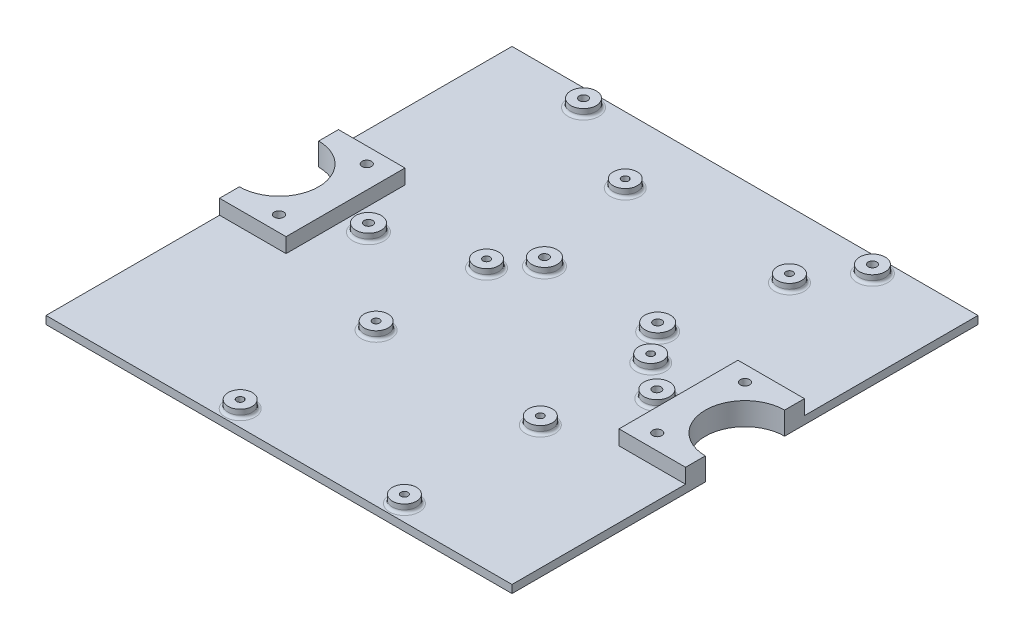
from build123d import *

# Parameters (mm, degrees)
SKETCH1_W               = 164.6
SKETCH1_H               = 164.6
BOSS_EXTRUDE1_DEPTH     = 2.8
SKETCH2_W               = 23.5
SKETCH2_H               = 42
BOSS_EXTRUDE2_DEPTH     = 5.2
CUT_EXTRUDE1_DEPTH      = 117.664390454
CUT_EXTRUDE1_DEPTH_BACK = 117.664390454
SKETCH3_R               = 14
SKETCH4_R               = 1.65
CUT_EXTRUDE2_DEPTH      = 117.664390454
SKETCH5_R               = 3
CUT_EXTRUDE3_DEPTH      = 3.2
SKETCH6_R               = 1.25
SKETCH6_R_2             = 1.5
CUT_EXTRUDE4_DEPTH      = 117.50587968
BOSS_EXTRUDE3_START     = 2.8
SKETCH7_R               = 4.25
SKETCH7_R_2             = 1.25
SKETCH7_R_3             = 4.5
SKETCH7_R_4             = 1.5
BOSS_EXTRUDE3_DEPTH     = 2.8
FILLET1_R               = 1


with BuildPart() as part:
    # Sketch1 → Boss-Extrude1 (new body)
    with BuildSketch(Plane(origin=(0, 0, 0), x_dir=(1, 0, 0), z_dir=(0, 1, 0))):
        Rectangle(SKETCH1_W, SKETCH1_H)
    extrude(amount=-BOSS_EXTRUDE1_DEPTH)

    # Sketch2 → Boss-Extrude2 (add)
    with BuildSketch(Plane(origin=(0, 0, 0), x_dir=(1, 0, 0), z_dir=(0, 1, 0))):
        with Locations((-70.55, 0)):
            Rectangle(SKETCH2_W, SKETCH2_H)
        with Locations((70.55, 0)):
            Rectangle(SKETCH2_W, SKETCH2_H)
    extrude(amount=BOSS_EXTRUDE2_DEPTH)

    # Sketch3 → Cut-Extrude1 (cut, two sides: drawn at the far end of the back side and taken through both)
    with BuildSketch(Plane.XZ.offset(2.8).offset(-CUT_EXTRUDE1_DEPTH_BACK)):
        with Locations((82.3, 0)):
            Circle(SKETCH3_R)
        with Locations((-82.3, 0)):
            Circle(SKETCH3_R)
    extrude(amount=CUT_EXTRUDE1_DEPTH + CUT_EXTRUDE1_DEPTH_BACK, mode=Mode.SUBTRACT)

    # Sketch4 → Cut-Extrude2 (cut, through all)
    with BuildSketch(Plane.XZ.offset(2.8)):
        with Locations(Location((-66.8, 15.5, 0), (0, 0, 270))):
            Circle(SKETCH4_R)
        with Locations(Location((-66.8, -15.5, 0), (0, 0, 270))):
            Circle(SKETCH4_R)
        with Locations(Location((66.8, 15.5, 0), (0, 0, 90))):
            Circle(SKETCH4_R)
        with Locations(Location((66.8, -15.5, 0), (0, 0, 90))):
            Circle(SKETCH4_R)
    extrude(amount=-CUT_EXTRUDE2_DEPTH, mode=Mode.SUBTRACT)

    # Sketch5 → Cut-Extrude3 (cut)
    with BuildSketch(Plane.XZ.offset(2.8)):
        with Locations(Location((66.8, 15.5, 0), (0, 0, 270))):
            Circle(SKETCH5_R)
        with Locations(Location((66.8, -15.5, 0), (0, 0, 270))):
            Circle(SKETCH5_R)
        with Locations(Location((-66.8, -15.5, 0), (0, 0, 270))):
            Circle(SKETCH5_R)
        with Locations(Location((-66.8, 15.5, 0), (0, 0, 270))):
            Circle(SKETCH5_R)
    extrude(amount=-CUT_EXTRUDE3_DEPTH, mode=Mode.SUBTRACT)

    # Sketch6 → Cut-Extrude4 (cut, through all)
    with BuildSketch(Plane(origin=(0, 0, 0), x_dir=(1, 0, 0), z_dir=(0, 1, 0))):
        with Locations(Location((-19.5, -76.5, 0), (0, 0, 270))):
            Circle(SKETCH6_R)
        with Locations(Location((-19.5, -28.5, 0), (0, 0, 270))):
            Circle(SKETCH6_R)
        with Locations(Location((38.5, -28.5, 0), (0, 0, 270))):
            Circle(SKETCH6_R)
        with Locations(Location((38.5, -76.5, 0), (0, 0, 270))):
            Circle(SKETCH6_R)
        with Locations(Location((-9.321007657, 20.777999975, 0), (0, 0, 270))):
            Circle(SKETCH6_R_2)
        with Locations(Location((30.679013943, 20.777999975, 0), (0, 0, 270))):
            Circle(SKETCH6_R_2)
        with Locations(Location((-50.86985, 0.1725, 0), (0, 0, 270))):
            Circle(SKETCH6_R_2)
        with Locations(Location((-19.00000146, 9.99999832, 0), (0, 0, 270))):
            Circle(SKETCH6_R)
        with Locations(Location((38.99999938, 9.99999832, 0), (0, 0, 270))):
            Circle(SKETCH6_R)
        with Locations(Location((50.98415, 0.1725, 0), (0, 0, 270))):
            Circle(SKETCH6_R_2)
        with Locations(Location((50.84445, 76.4741, 0), (0, 0, 270))):
            Circle(SKETCH6_R_2)
        with Locations(Location((-51.00955, 76.2709, 0), (0, 0, 270))):
            Circle(SKETCH6_R_2)
        with Locations(Location((-19.00000146, 58.99999938, 0), (0, 0, 270))):
            Circle(SKETCH6_R)
        with Locations(Location((38.99999938, 58.99999938, 0), (0, 0, 270))):
            Circle(SKETCH6_R)
    extrude(amount=-CUT_EXTRUDE4_DEPTH, mode=Mode.SUBTRACT)

    # Sketch7 → Boss-Extrude3 (add)
    # profile 1 of 14: a face of its own
    with BuildSketch(Plane(origin=(0, 0, 0), x_dir=(1, 0, 0), z_dir=(0, 1, 0)).offset(BOSS_EXTRUDE3_START)):
        with Locations(Location((38.5, -76.5, 0), (0, 0, 90))):
            Circle(SKETCH7_R)
        with Locations(Location((38.5, -76.5, 0), (0, 0, 270))):
            Circle(SKETCH7_R_2, mode=Mode.SUBTRACT)
    # profile 2 of 14: a face of its own
    with BuildSketch(Plane(origin=(0, 0, 0), x_dir=(1, 0, 0), z_dir=(0, 1, 0)).offset(BOSS_EXTRUDE3_START)):
        with Locations(Location((-19.5, -76.5, 0), (0, 0, 90))):
            Circle(SKETCH7_R)
        with Locations(Location((-19.5, -76.5, 0), (0, 0, 270))):
            Circle(SKETCH7_R_2, mode=Mode.SUBTRACT)
    # profile 3 of 14: a face of its own
    with BuildSketch(Plane(origin=(0, 0, 0), x_dir=(1, 0, 0), z_dir=(0, 1, 0)).offset(BOSS_EXTRUDE3_START)):
        with Locations(Location((-19.5, -28.5, 0), (0, 0, 90))):
            Circle(SKETCH7_R)
        with Locations(Location((-19.5, -28.5, 0), (0, 0, 270))):
            Circle(SKETCH7_R_2, mode=Mode.SUBTRACT)
    # profile 4 of 14: a face of its own
    with BuildSketch(Plane(origin=(0, 0, 0), x_dir=(1, 0, 0), z_dir=(0, 1, 0)).offset(BOSS_EXTRUDE3_START)):
        with Locations(Location((38.5, -28.5, 0), (0, 0, 90))):
            Circle(SKETCH7_R)
        with Locations(Location((38.5, -28.5, 0), (0, 0, 270))):
            Circle(SKETCH7_R_2, mode=Mode.SUBTRACT)
    # profile 5 of 14: a face of its own
    with BuildSketch(Plane(origin=(0, 0, 0), x_dir=(1, 0, 0), z_dir=(0, 1, 0)).offset(BOSS_EXTRUDE3_START)):
        with Locations(Location((50.98415, 0.1725, 0), (0, 0, 90))):
            Circle(SKETCH7_R_3)
        with Locations(Location((50.98415, 0.1725, 0), (0, 0, 270))):
            Circle(SKETCH7_R_4, mode=Mode.SUBTRACT)
    # profile 6 of 14: a face of its own
    with BuildSketch(Plane(origin=(0, 0, 0), x_dir=(1, 0, 0), z_dir=(0, 1, 0)).offset(BOSS_EXTRUDE3_START)):
        with Locations(Location((38.99999938, 9.99999832, 0), (0, 0, 90))):
            Circle(SKETCH7_R)
        with Locations(Location((38.99999938, 9.99999832, 0), (0, 0, 270))):
            Circle(SKETCH7_R_2, mode=Mode.SUBTRACT)
    # profile 7 of 14: a face of its own
    with BuildSketch(Plane(origin=(0, 0, 0), x_dir=(1, 0, 0), z_dir=(0, 1, 0)).offset(BOSS_EXTRUDE3_START)):
        with Locations(Location((30.679013943, 20.777999975, 0), (0, 0, 90))):
            Circle(SKETCH7_R_3)
        with Locations(Location((30.679013943, 20.777999975, 0), (0, 0, 270))):
            Circle(SKETCH7_R_4, mode=Mode.SUBTRACT)
    # profile 8 of 14: a face of its own
    with BuildSketch(Plane(origin=(0, 0, 0), x_dir=(1, 0, 0), z_dir=(0, 1, 0)).offset(BOSS_EXTRUDE3_START)):
        with Locations(Location((-9.321007657, 20.777999975, 0), (0, 0, 90))):
            Circle(SKETCH7_R_3)
        with Locations(Location((-9.321007657, 20.777999975, 0), (0, 0, 270))):
            Circle(SKETCH7_R_4, mode=Mode.SUBTRACT)
    # profile 9 of 14: a face of its own
    with BuildSketch(Plane(origin=(0, 0, 0), x_dir=(1, 0, 0), z_dir=(0, 1, 0)).offset(BOSS_EXTRUDE3_START)):
        with Locations(Location((-19.00000146, 9.99999832, 0), (0, 0, 90))):
            Circle(SKETCH7_R)
        with Locations(Location((-19.00000146, 9.99999832, 0), (0, 0, 270))):
            Circle(SKETCH7_R_2, mode=Mode.SUBTRACT)
    # profile 10 of 14: a face of its own
    with BuildSketch(Plane(origin=(0, 0, 0), x_dir=(1, 0, 0), z_dir=(0, 1, 0)).offset(BOSS_EXTRUDE3_START)):
        with Locations(Location((-50.86985, 0.1725, 0), (0, 0, 90))):
            Circle(SKETCH7_R_3)
        with Locations(Location((-50.86985, 0.1725, 0), (0, 0, 270))):
            Circle(SKETCH7_R_4, mode=Mode.SUBTRACT)
    # profile 11 of 14: a face of its own
    with BuildSketch(Plane(origin=(0, 0, 0), x_dir=(1, 0, 0), z_dir=(0, 1, 0)).offset(BOSS_EXTRUDE3_START)):
        with Locations(Location((50.84445, 76.4741, 0), (0, 0, 90))):
            Circle(SKETCH7_R_3)
        with Locations(Location((50.84445, 76.4741, 0), (0, 0, 270))):
            Circle(SKETCH7_R_4, mode=Mode.SUBTRACT)
    # profile 12 of 14: a face of its own
    with BuildSketch(Plane(origin=(0, 0, 0), x_dir=(1, 0, 0), z_dir=(0, 1, 0)).offset(BOSS_EXTRUDE3_START)):
        with Locations(Location((38.99999938, 58.99999938, 0), (0, 0, 90))):
            Circle(SKETCH7_R)
        with Locations(Location((38.99999938, 58.99999938, 0), (0, 0, 270))):
            Circle(SKETCH7_R_2, mode=Mode.SUBTRACT)
    # profile 13 of 14: a face of its own
    with BuildSketch(Plane(origin=(0, 0, 0), x_dir=(1, 0, 0), z_dir=(0, 1, 0)).offset(BOSS_EXTRUDE3_START)):
        with Locations(Location((-19.00000146, 58.99999938, 0), (0, 0, 90))):
            Circle(SKETCH7_R)
        with Locations(Location((-19.00000146, 58.99999938, 0), (0, 0, 270))):
            Circle(SKETCH7_R_2, mode=Mode.SUBTRACT)
    # profile 14 of 14: a face of its own
    with BuildSketch(Plane(origin=(0, 0, 0), x_dir=(1, 0, 0), z_dir=(0, 1, 0)).offset(BOSS_EXTRUDE3_START)):
        with Locations(Location((-51.00955, 76.2709, 0), (0, 0, 90))):
            Circle(SKETCH7_R_3)
        with Locations(Location((-51.00955, 76.2709, 0), (0, 0, 270))):
            Circle(SKETCH7_R_4, mode=Mode.SUBTRACT)
    extrude(amount=-BOSS_EXTRUDE3_DEPTH)

    # Fillet1
    fillet1_edges = [part.edges().sort_by_distance(p)[0] for p in [
        (38.5, 0, 80.75),
        (-19.5, 0, 80.75),
        (-19.5, 0, 32.75),
        (38.5, 0, 32.75),
        (50.98415, 0, 4.3275),
        (38.99999938, 0, -5.74999832),
        (30.679013943, 0, -16.277999975),
        (-9.321007657, 0, -16.277999975),
        (-19.00000146, 0, -5.74999832),
        (-50.86985, 0, 4.3275),
        (50.84445, 0, -71.9741),
        (38.99999938, 0, -54.74999938),
        (-19.00000146, 0, -54.74999938),
        (-51.00955, 0, -71.7709),
    ]]
    fillet(fillet1_edges, radius=FILLET1_R)


solid = part.part
